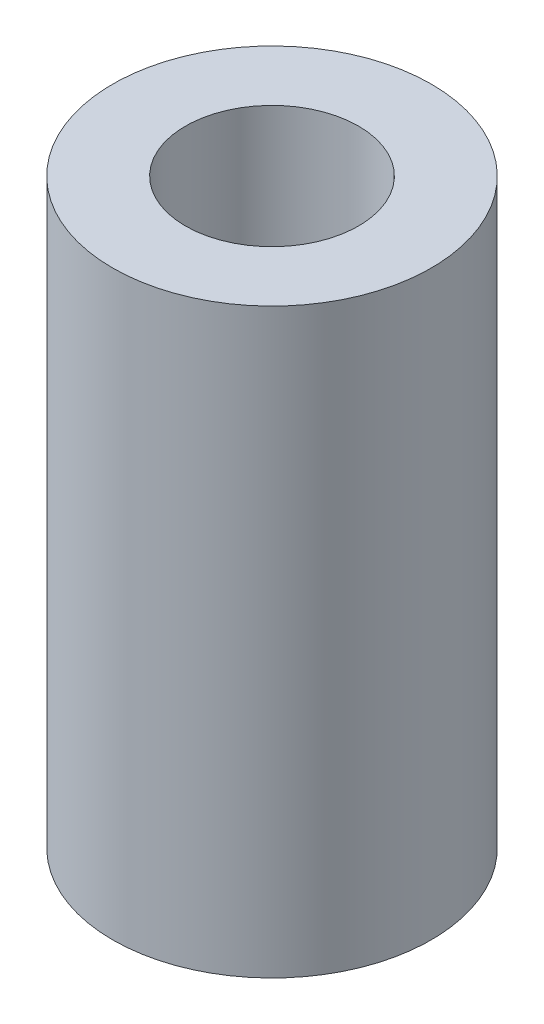
from build123d import *

# Parameters (mm, degrees)
SKETCH1_R           = 3.8328
SKETCH1_R_2         = 2.0828
BOSS_EXTRUDE1_DEPTH = 14


with BuildPart() as part:
    # Sketch1 → Boss-Extrude1 (new body)
    with BuildSketch(Plane(origin=(0, 0, 0), x_dir=(1, 0, 0), z_dir=(0, 1, 0))):
        with Locations(Location((0, 0, 0), (0, 0, 270))):
            Circle(SKETCH1_R)
        with Locations(Location((0, 0, 0), (0, 0, 270))):
            Circle(SKETCH1_R_2, mode=Mode.SUBTRACT)
    extrude(amount=BOSS_EXTRUDE1_DEPTH)


solid = part.part
